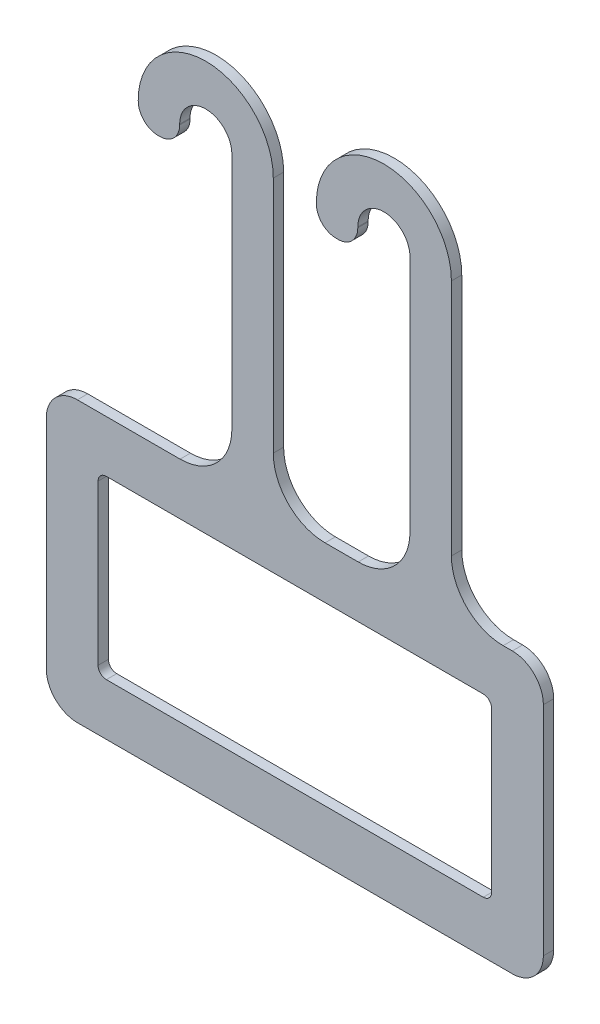
from build123d import *

# Parameters (mm, degrees)
BOSS_EXTRUDE1_DEPTH = 3.175
FILLET1_R           = 6.096


with BuildPart() as part:
    # Sketch1 → Boss-Extrude1 (new body)
    with BuildSketch(Plane.XY):
        with BuildLine():
            Line((-66.675, 42.8625), (-35.179, 42.8625))
            ThreePointArc((-35.179, 42.8625), (-23.953679849, 47.512179849), (-19.304, 58.7375))
            Line((-19.304, 58.7375), (-19.304, 131.7625))
            ThreePointArc((-19.304, 131.7625), (-27.305, 139.7635), (-35.306, 131.7625))
            Line((-35.306, 131.7625), (-35.306, 125.4125))
            Line((-35.306, 125.4125), (-48.006, 125.4125))
            Line((-48.006, 125.4125), (-48.006, 131.7625))
            ThreePointArc((-48.006, 131.7625), (-27.305, 152.4635), (-6.604, 131.7625))
            Line((-6.604, 131.7625), (-6.604, 58.7375))
            ThreePointArc((-6.604, 58.7375), (-1.954320151, 47.512179849), (9.271, 42.8625))
            Line((9.271, 42.8625), (19.431, 42.8625))
            ThreePointArc((19.431, 42.8625), (30.656320151, 47.512179849), (35.306, 58.7375))
            Line((35.306, 58.7375), (35.306, 131.7625))
            ThreePointArc((35.306, 131.7625), (27.305, 139.7635), (19.304, 131.7625))
            Line((19.304, 131.7625), (19.304, 125.4125))
            Line((19.304, 125.4125), (6.604, 125.4125))
            Line((6.604, 125.4125), (6.604, 131.7625))
            ThreePointArc((6.604, 131.7625), (27.305, 152.4635), (48.006, 131.7625))
            Line((48.006, 131.7625), (48.006, 58.7375))
            ThreePointArc((48.006, 58.7375), (52.655679849, 47.512179849), (63.881, 42.8625))
            Line((63.881, 42.8625), (66.675, 42.8625))
            ThreePointArc((66.675, 42.8625), (73.410192091, 40.072692091), (76.2, 33.3375))
            Line((76.2, 33.3375), (76.2, -33.3375))
            ThreePointArc((76.2, -33.3375), (73.410192091, -40.072692091), (66.675, -42.8625))
            Line((66.675, -42.8625), (-66.675, -42.8625))
            ThreePointArc((-66.675, -42.8625), (-73.410192091, -40.072692091), (-76.2, -33.3375))
            Line((-76.2, -33.3375), (-76.2, 33.3375))
            ThreePointArc((-76.2, 33.3375), (-73.410192091, 40.072692091), (-66.675, 42.8625))
        make_face()
        with BuildLine():
            Line((-57.785, 26.9875), (57.785, 26.9875))
            ThreePointArc((57.785, 26.9875), (59.581051224, 26.243551224), (60.325, 24.4475))
            Line((60.325, 24.4475), (60.325, -24.4475))
            ThreePointArc((60.325, -24.4475), (59.581051224, -26.243551224), (57.785, -26.9875))
            Line((57.785, -26.9875), (-57.785, -26.9875))
            ThreePointArc((-57.785, -26.9875), (-59.581051224, -26.243551224), (-60.325, -24.4475))
            Line((-60.325, -24.4475), (-60.325, 24.4475))
            ThreePointArc((-60.325, 24.4475), (-59.581051224, 26.243551224), (-57.785, 26.9875))
        make_face(mode=Mode.SUBTRACT)
    extrude(amount=BOSS_EXTRUDE1_DEPTH)

    # Fillet1
    fillet1_edges = [part.edges().sort_by_distance(p)[0] for p in [
        (-35.306, 125.4125, 1.5875),
        (-48.006, 125.4125, 1.5875),
        (19.304, 125.4125, 1.5875),
        (6.604, 125.4125, 1.5875),
    ]]
    fillet(fillet1_edges, radius=FILLET1_R)


solid = part.part
